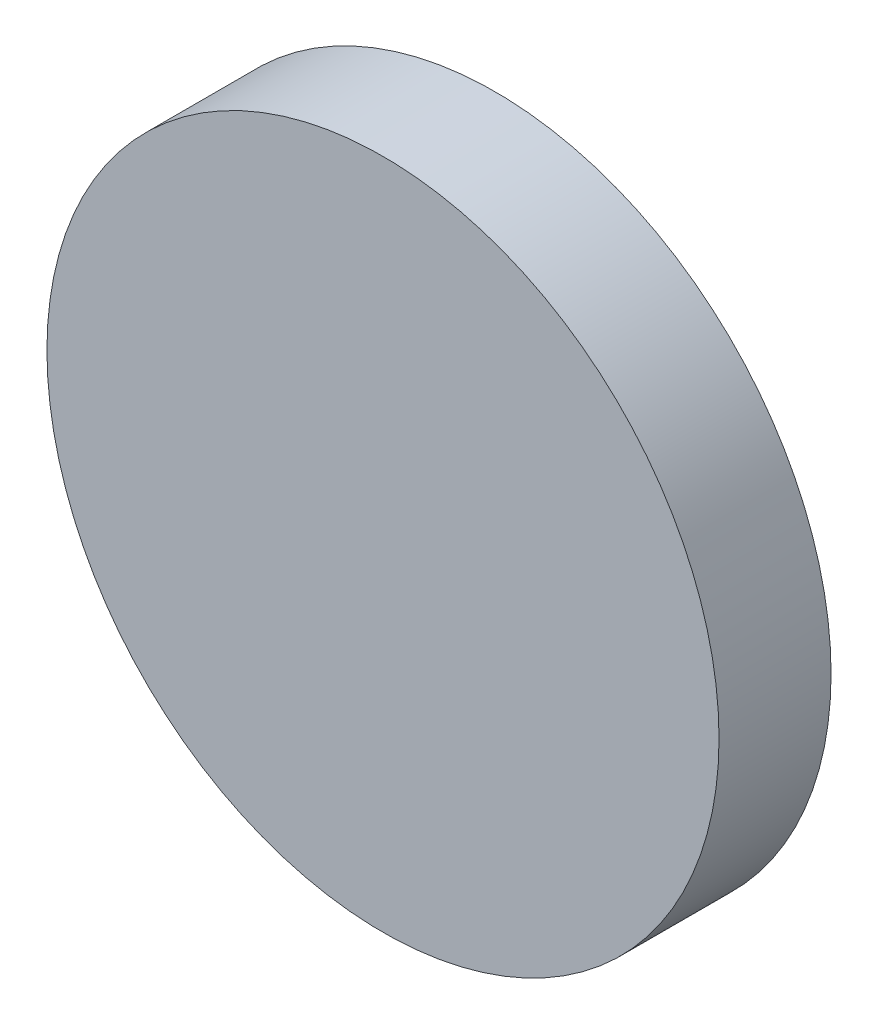
from build123d import *

# Parameters (mm, degrees)
CROQUIS1_R              = 6
SALIENTE_EXTRUIR1_DEPTH = 2


with BuildPart() as part:
    # Croquis1 → Saliente-Extruir1 (new body)
    with BuildSketch(Plane.XY):
        Circle(CROQUIS1_R)
    extrude(amount=SALIENTE_EXTRUIR1_DEPTH)


solid = part.part
